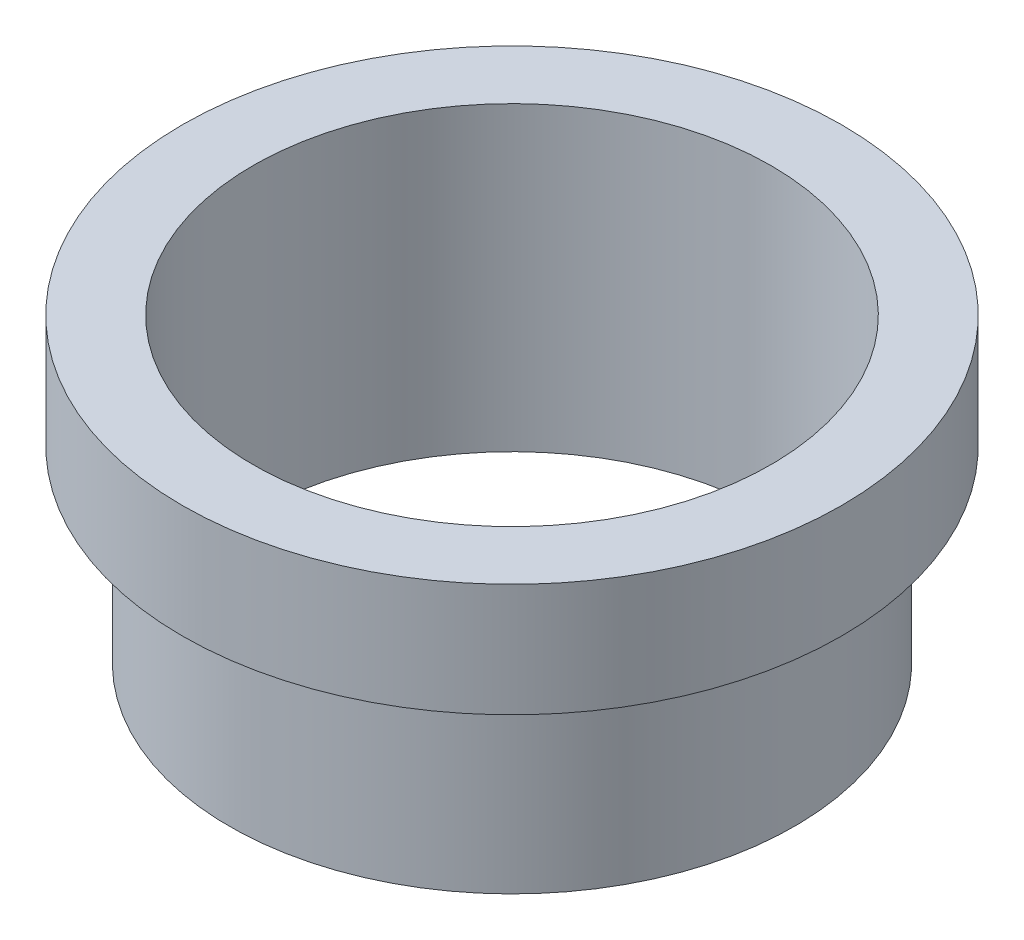
from build123d import *


with BuildPart() as part:
    # Sketch1 → Revolve1 (revolve)
    with BuildSketch(Plane.XY):
        Polygon((-17.4625, 0), (-17.4625, -20.32), (-19.05, -20.32), (-19.05, -7.62), (-22.225, -7.62), (-22.225, 0), align=None)
    revolve(axis=Axis((0, 0, 0), (0, 1, 0)))


solid = part.part
